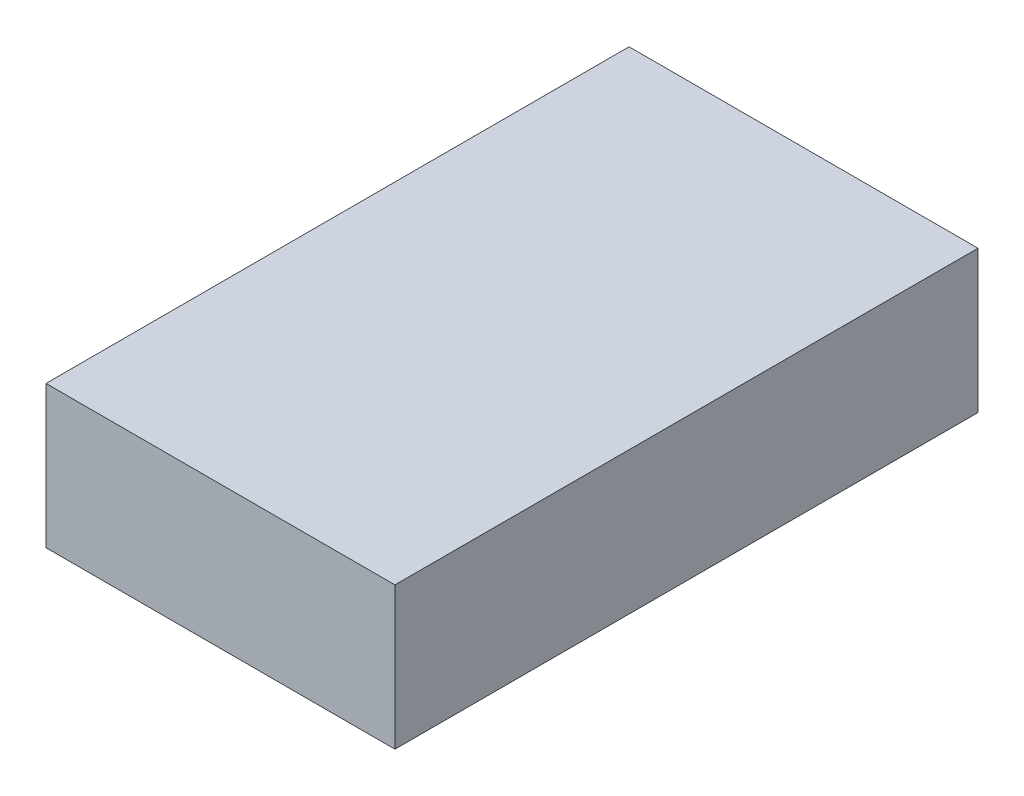
from build123d import *

# Parameters (mm, degrees)
SKETCH1_W           = 76
SKETCH1_H           = 127
BOSS_EXTRUDE1_DEPTH = 31


with BuildPart() as part:
    # Sketch1 → Boss-Extrude1 (new body)
    with BuildSketch(Plane(origin=(0, 0, 0), x_dir=(1, 0, 0), z_dir=(0, 1, 0))):
        with Locations((38, 63.5)):
            Rectangle(SKETCH1_W, SKETCH1_H)
    extrude(amount=BOSS_EXTRUDE1_DEPTH)


solid = part.part
